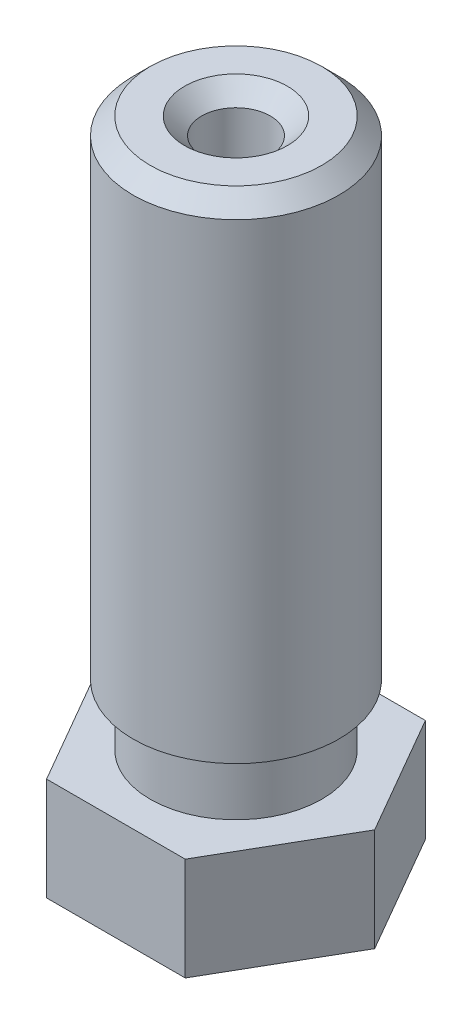
from build123d import *

# Parameters (mm, degrees)
BOSS_EXTRUDE1_DEPTH = 21
CHAMFER1_SIZE       = 0.5


with BuildPart() as part:
    # Sketch1 → Boss-Extrude1 (new body)
    with BuildSketch(Plane(origin=(0, 0, 0), x_dir=(1, 0, 0), z_dir=(0, 1, 0))):
        Polygon((4.041451884, 0), (2.020725942, 3.5), (-2.020725942, 3.5), (-4.041451884, 0), (-2.020725942, -3.5), (2.020725942, -3.5), align=None)
    extrude(amount=BOSS_EXTRUDE1_DEPTH)

    # Sketch2 → Cut-Revolve1 (revolve, cut)
    with BuildSketch(Plane.XY, mode=Mode.PRIVATE) as cut_revolve1_sk:
        Polygon((-1, 1.985640646), (-1, 21.445867252), (0, 21.445867252), (0, 0), (-0.2, 0), (-0.2, 0.6), align=None)
        Polygon((-3, 22.847292178), (-3, 6.770566956), (-2.5, 6.5), (-2.5, 5), (-6.012196156, 5), (-6.012196156, 2), (-1.654700538, 2), (-0.5, 0), (-0.5, -1.473098258), (-7.184398373, -1.473098258), (-7.184398373, 22.847292178), align=None)
    revolve(cut_revolve1_sk.sketch.rotate(Axis((0, 22.126511162, 0), (0, -1, 0)), 270), axis=Axis((0, 22.126511162, 0), (0, -1, 0)), mode=Mode.SUBTRACT)

    # Chamfer1
    chamfer1_edges = [part.edges().sort_by_distance(p)[0] for p in [
        (0, 21, -1),
        (0, 21, -3),
    ]]
    chamfer(chamfer1_edges, length=CHAMFER1_SIZE)


solid = part.part
